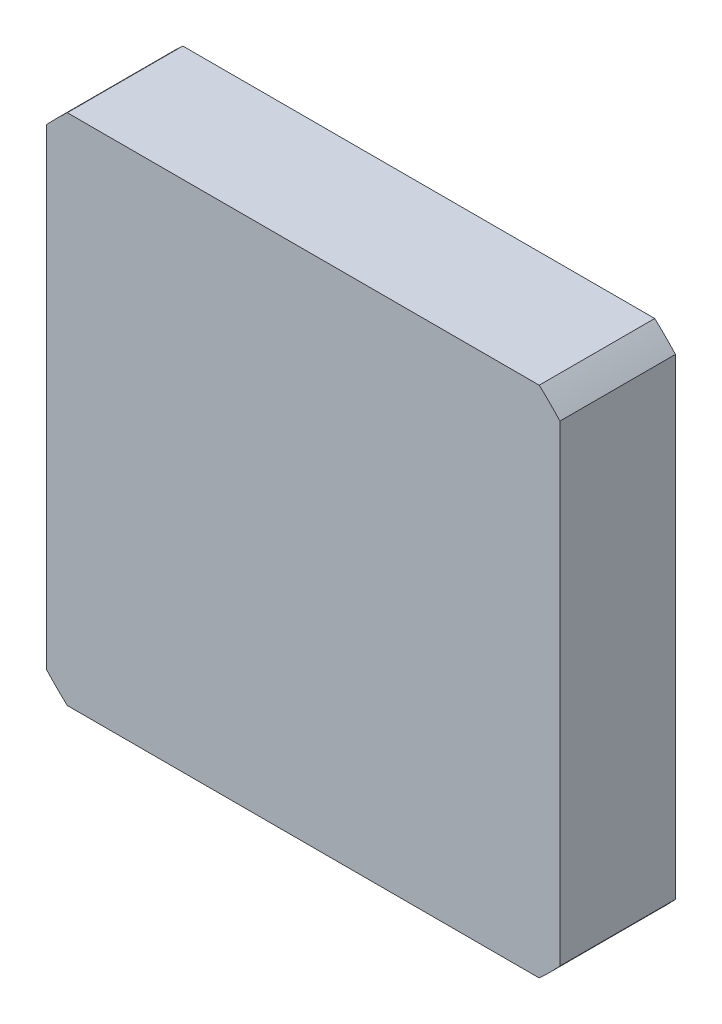
from build123d import *

# Parameters (mm, degrees)
BOSS_EXTRUDE1_DEPTH = 27


with BuildPart() as part:
    # Sketch1 → Boss-Extrude1 (new body)
    with BuildSketch(Plane.XY):
        with BuildLine():
            Line((55.156595254, 60), (-55.156595254, 60))
            ThreePointArc((-55.156595254, 60), (-57.629202667, 57.629202667), (-60, 55.156595254))
            Line((-60, 55.156595254), (-60, -55.156595254))
            ThreePointArc((-60, -55.156595254), (-57.629202667, -57.629202667), (-55.156595254, -60))
            Line((-55.156595254, -60), (55.156595254, -60))
            ThreePointArc((55.156595254, -60), (57.629202667, -57.629202667), (60, -55.156595254))
            Line((60, -55.156595254), (60, 55.156595254))
            ThreePointArc((60, 55.156595254), (57.629202667, 57.629202667), (55.156595254, 60))
        make_face()
    extrude(amount=BOSS_EXTRUDE1_DEPTH)


solid = part.part
